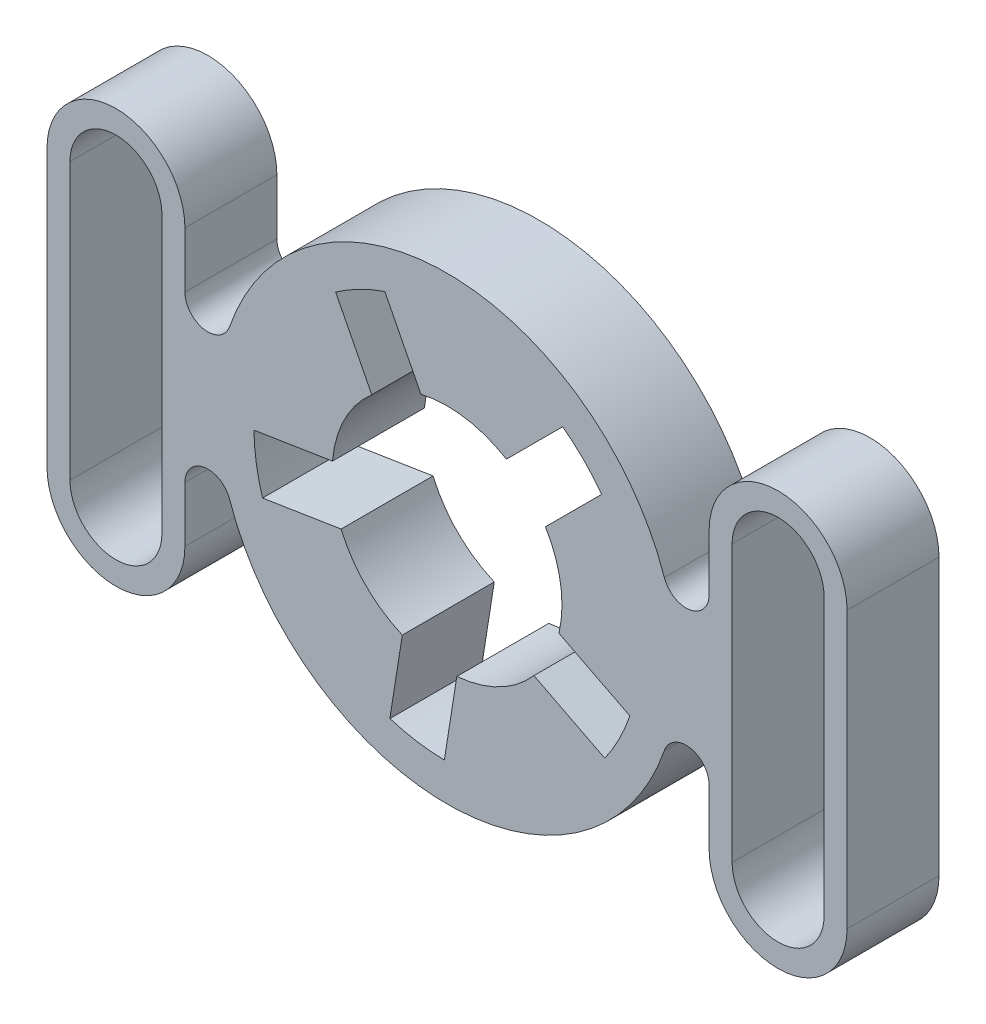
from build123d import *

# Parameters (mm, degrees)
BOSS_EXTRUDE1_DEPTH = 10


with BuildPart() as part:
    # Sketch1 → Boss-Extrude1 (new, symmetric)
    with BuildSketch(Plane.XY):
        with BuildLine():
            Line((87, -30), (87, 30))
            ThreePointArc((87, 30), (72, 45), (57, 30))
            Line((57, 30), (57, 17.916472867))
            ThreePointArc((57, 17.916472867), (52.825722824, 12.985126011), (47.272727273, 16.287702607))
            ThreePointArc((47.272727273, 16.287702607), (0, 50), (-47.272727273, 16.287702607))
            ThreePointArc((-47.272727273, 16.287702607), (-52.825722824, 12.985126011), (-57, 17.916472867))
            Line((-57, 17.916472867), (-57, 30))
            ThreePointArc((-57, 30), (-72, 45), (-87, 30))
            Line((-87, 30), (-87, -30))
            ThreePointArc((-87, -30), (-72, -45), (-57, -30))
            Line((-57, -30), (-57, -17.916472867))
            ThreePointArc((-57, -17.916472867), (-52.825722824, -12.985126011), (-47.272727273, -16.287702607))
            ThreePointArc((-47.272727273, -16.287702607), (0, -50), (47.272727273, -16.287702607))
            ThreePointArc((47.272727273, -16.287702607), (52.825722824, -12.985126011), (57, -17.916472867))
            Line((57, -17.916472867), (57, -30))
            ThreePointArc((57, -30), (72, -45), (87, -30))
        make_face()
        with BuildLine():
            ThreePointArc((25.151236226, 33.636517601), (29.69848481, 29.69848481), (33.636517601, 25.151236226))
            Line((33.636517601, 25.151236226), (21.403642989, 12.918361615))
            ThreePointArc((21.403642989, 12.918361615), (24.084134557, 6.704808919), (25, 0))
            ThreePointArc((25, 0), (24.836482092, -2.85467289), (24.348067415, -5.672002568))
            Line((24.348067415, -5.672002568), (39.762388673, -13.525991536))
            ThreePointArc((39.762388673, -13.525991536), (37.422274016, -19.067600989), (34.314502676, -24.218069826))
            Line((34.314502676, -24.218069826), (18.900181419, -16.364080859))
            ThreePointArc((18.900181419, -16.364080859), (11.349762493, -22.275163105), (2.129571608, -24.90913336))
            Line((2.129571608, -24.90913336), (-0.576728553, -41.996040101))
            ThreePointArc((-0.576728553, -41.996040101), (-6.570247532, -41.482910305), (-12.42898864, -40.118826521))
            Line((-12.42898864, -40.118826521), (-9.722688479, -23.03191978))
            ThreePointArc((-9.722688479, -23.03191978), (-17.67766953, -17.67766953), (-23.03191978, -9.722688479))
            Line((-23.03191978, -9.722688479), (-40.118826521, -12.42898864))
            ThreePointArc((-40.118826521, -12.42898864), (-41.482910305, -6.570247532), (-41.996040101, -0.576728553))
            Line((-41.996040101, -0.576728553), (-24.90913336, 2.129571608))
            ThreePointArc((-24.90913336, 2.129571608), (-22.275163105, 11.349762493), (-16.364080859, 18.900181419))
            Line((-16.364080859, 18.900181419), (-24.218069826, 34.314502676))
            ThreePointArc((-24.218069826, 34.314502676), (-19.067600989, 37.422274016), (-13.525991536, 39.762388673))
            Line((-13.525991536, 39.762388673), (-5.672002568, 24.348067415))
            ThreePointArc((-5.672002568, 24.348067415), (3.910861626, 24.692208515), (12.918361615, 21.403642989))
            Line((12.918361615, 21.403642989), (25.151236226, 33.636517601))
        make_face(mode=Mode.SUBTRACT)
        with BuildLine():
            Line((-82, -30), (-82, 30))
            ThreePointArc((-82, 30), (-72, 40), (-62, 30))
            Line((-62, 30), (-62, -30))
            ThreePointArc((-62, -30), (-72, -40), (-82, -30))
        make_face(mode=Mode.SUBTRACT)
        with BuildLine():
            ThreePointArc((62, 30), (72, 40), (82, 30))
            Line((82, 30), (82, -30))
            ThreePointArc((82, -30), (72, -40), (62, -30))
            Line((62, -30), (62, 30))
        make_face(mode=Mode.SUBTRACT)
    extrude(amount=BOSS_EXTRUDE1_DEPTH, both=True)


solid = part.part
